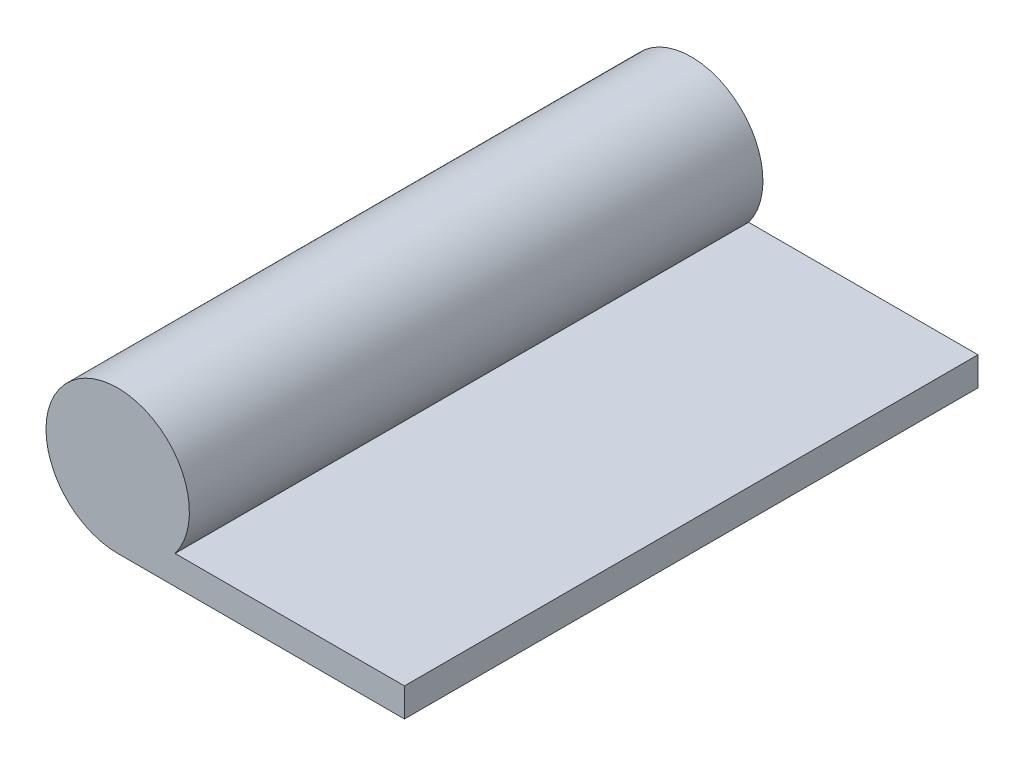
from build123d import *

# Parameters (mm, degrees)
BOSS_EXTRUDE1_DEPTH = 100


with BuildPart() as part:
    # Sketch1 → Boss-Extrude1 (new body)
    with BuildSketch(Plane.XY):
        with BuildLine():
            Line((0, -12.5), (50, -12.5))
            Line((50, -12.5), (50, -7.5))
            Line((50, -7.5), (10, -7.5))
            ThreePointArc((10, -7.5), (-5.590169944, 11.180339887), (0, -12.5))
        make_face()
    extrude(amount=BOSS_EXTRUDE1_DEPTH)


solid = part.part
